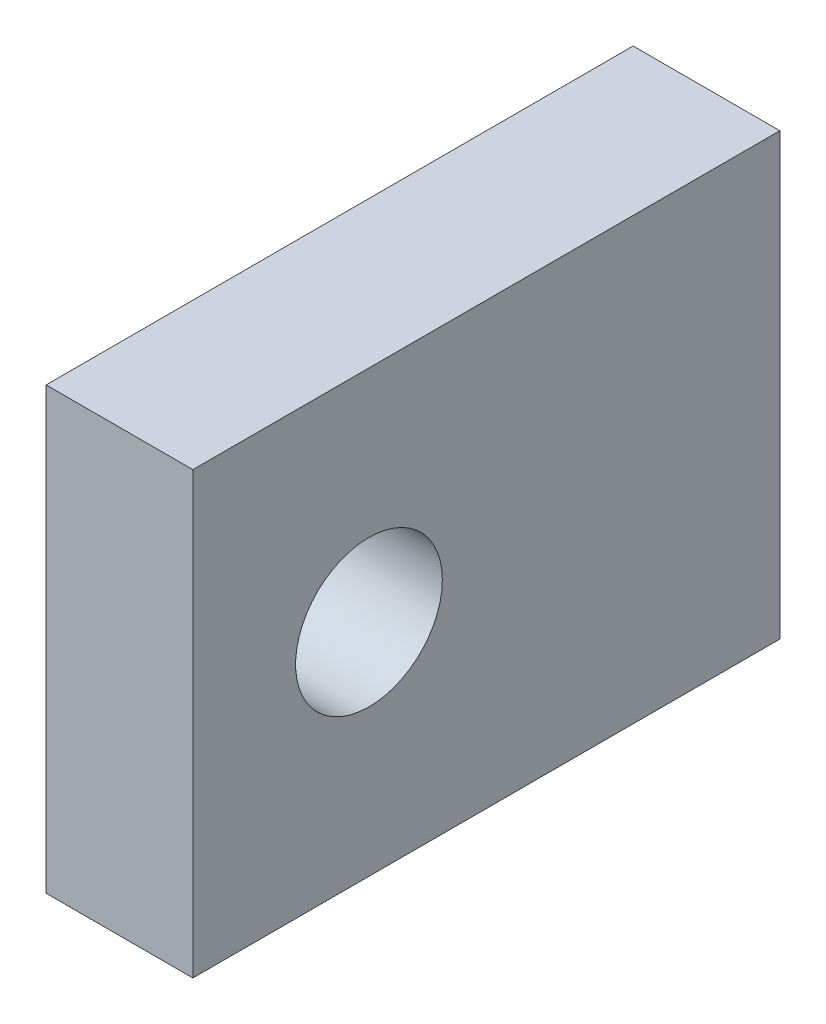
from build123d import *

# Parameters (mm, degrees)
SKETCH1_W           = 50.8
SKETCH1_H           = 38.1
SKETCH1_R           = 6.35
BOSS_EXTRUDE1_DEPTH = 12.7


with BuildPart() as part:
    # Sketch1 → Boss-Extrude1 (new body)
    with BuildSketch(Plane(origin=(0, 0, 0), x_dir=(0, 0, -1), z_dir=(1, 0, 0))):
        Rectangle(SKETCH1_W, SKETCH1_H)
        with Locations((-10.16, 0)):
            Circle(SKETCH1_R, mode=Mode.SUBTRACT)
    extrude(amount=BOSS_EXTRUDE1_DEPTH)


solid = part.part
